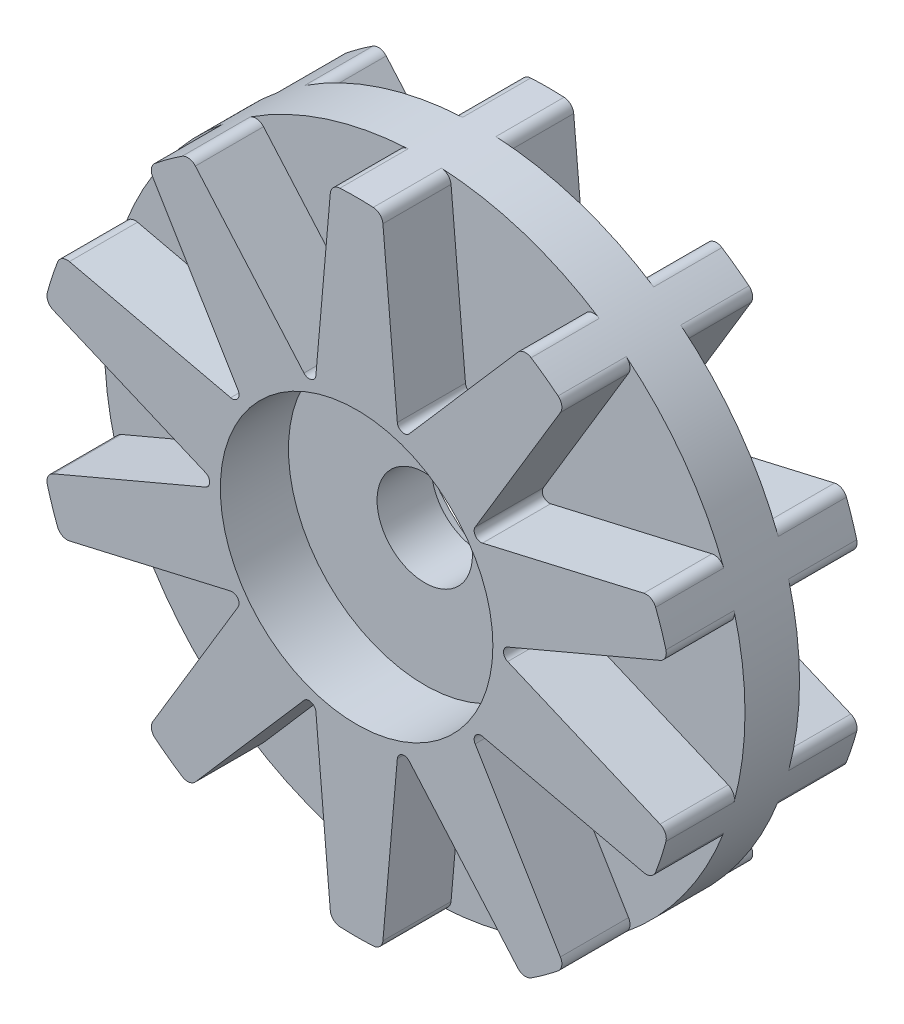
from build123d import *

# Parameters (mm, degrees)
SCHIZZO1_R                   = 94
SCHIZZO1_R_2                 = 14
ESTRUSIONE_ESTRUSIONE1_DEPTH = 16
SCHIZZO2_R                   = 40
ESTRUSIONE_ESTRUSIONE2_DEPTH = 20
RIPETIZIONE_A_L1_COUNT       = 2
RIPETIZIONE_A_L1_PITCH       = 36


with BuildPart() as part:
    # Schizzo1 → Estrusione-Estrusione1 (new body)
    with BuildSketch(Plane.XY):
        Circle(SCHIZZO1_R)
        Circle(SCHIZZO1_R_2, mode=Mode.SUBTRACT)
    extrude(amount=ESTRUSIONE_ESTRUSIONE1_DEPTH)

    # Schizzo2 → Estrusione-Estrusione2 (add)
    with BuildSketch(Plane.XY.offset(16)):
        with BuildLine():
            Line((-7.723794743, 91.137719524), (-11.950583321, 42.738141458))
            ThreePointArc((-11.950583321, 42.738141458), (-12.3776863, 41.667234504), (-13.32496596, 41.010028369))
            ThreePointArc((-13.32496596, 41.010028369), (-14.477627377, 40.984922287), (-15.45262426, 41.60025938))
            Line((-15.45262426, 41.60025938), (-47.320726256, 78.271896566))
            ThreePointArc((-47.320726256, 78.271896566), (-49.167859056, 79.274908037), (-51.219838417, 78.819592441))
            ThreePointArc((-51.219838417, 78.819592441), (-55.251813715, 76.047597471), (-59.134086483, 73.069554644))
            ThreePointArc((-59.134086483, 73.069554644), (-60.201213842, 71.258706558), (-59.818088672, 69.192031282))
            Line((-59.818088672, 69.192031282), (-34.789074258, 27.551506115))
            ThreePointArc((-34.789074258, 27.551506115), (-34.505144513, 26.434079358), (-34.885213782, 25.345591411))
            ThreePointArc((-34.885213782, 25.345591411), (-35.802979473, 24.647762783), (-36.953454589, 24.572492159))
            Line((-36.953454589, 24.572492159), (-84.290338197, 35.508869483))
            ThreePointArc((-84.290338197, 35.508869483), (-86.374255374, 35.23460539), (-87.766713757, 33.660124128))
            ThreePointArc((-87.766713757, 33.660124128), (-89.399312532, 29.047597471), (-90.789687523, 24.356367536))
            ThreePointArc((-90.789687523, 24.356367536), (-90.588621893, 22.264118936), (-89.063905871, 20.817338841))
            Line((-89.063905871, 20.817338841), (-44.339321267, 1.841131878))
            ThreePointArc((-44.339321267, 1.841131878), (-43.452810309, 1.104004358), (-43.120495645, 0))
            ThreePointArc((-43.120495645, 0), (-43.452810309, -1.104004358), (-44.339321267, -1.841131878))
            Line((-44.339321267, -1.841131878), (-89.063905871, -20.817338841))
            ThreePointArc((-89.063905871, -20.817338841), (-90.588621893, -22.264118936), (-90.789687523, -24.356367536))
            ThreePointArc((-90.789687523, -24.356367536), (-89.399312532, -29.047597471), (-87.766713757, -33.660124128))
            ThreePointArc((-87.766713757, -33.660124128), (-86.374255374, -35.23460539), (-84.290338197, -35.508869483))
            Line((-84.290338197, -35.508869483), (-36.953454589, -24.572492159))
            ThreePointArc((-36.953454589, -24.572492159), (-35.802979473, -24.647762783), (-34.885213782, -25.345591411))
            ThreePointArc((-34.885213782, -25.345591411), (-34.505144513, -26.434079358), (-34.789074258, -27.551506115))
            Line((-34.789074258, -27.551506115), (-59.818088672, -69.192031282))
            ThreePointArc((-59.818088672, -69.192031282), (-60.201213842, -71.258706558), (-59.134086483, -73.069554644))
            ThreePointArc((-59.134086483, -73.069554644), (-55.251813715, -76.047597471), (-51.219838417, -78.819592441))
            ThreePointArc((-51.219838417, -78.819592441), (-49.167859056, -79.274908037), (-47.320726256, -78.271896566))
            Line((-47.320726256, -78.271896566), (-15.45262426, -41.60025938))
            ThreePointArc((-15.45262426, -41.60025938), (-14.477627377, -40.984922287), (-13.32496596, -41.010028369))
            ThreePointArc((-13.32496596, -41.010028369), (-12.3776863, -41.667234504), (-11.950583321, -42.738141458))
            Line((-11.950583321, -42.738141458), (-7.723794743, -91.137719524))
            ThreePointArc((-7.723794743, -91.137719524), (-6.818988268, -93.034890269), (-4.8912743, -93.872655421))
            ThreePointArc((-4.8912743, -93.872655421), (0, -94), (4.8912743, -93.872655421))
            ThreePointArc((4.8912743, -93.872655421), (6.818988268, -93.034890269), (7.723794743, -91.137719524))
            Line((7.723794743, -91.137719524), (11.950583321, -42.738141458))
            ThreePointArc((11.950583321, -42.738141458), (12.3776863, -41.667234504), (13.32496596, -41.010028369))
            ThreePointArc((13.32496596, -41.010028369), (14.477627377, -40.984922287), (15.45262426, -41.60025938))
            Line((15.45262426, -41.60025938), (47.320726256, -78.271896566))
            ThreePointArc((47.320726256, -78.271896566), (49.167859056, -79.274908037), (51.219838417, -78.819592441))
            ThreePointArc((51.219838417, -78.819592441), (55.251813715, -76.047597471), (59.134086483, -73.069554644))
            ThreePointArc((59.134086483, -73.069554644), (60.201213842, -71.258706558), (59.818088672, -69.192031282))
            Line((59.818088672, -69.192031282), (34.789074258, -27.551506115))
            ThreePointArc((34.789074258, -27.551506115), (34.505144513, -26.434079358), (34.885213782, -25.345591411))
            ThreePointArc((34.885213782, -25.345591411), (35.802979473, -24.647762783), (36.953454589, -24.572492159))
            Line((36.953454589, -24.572492159), (84.290338197, -35.508869483))
            ThreePointArc((84.290338197, -35.508869483), (86.374255374, -35.23460539), (87.766713757, -33.660124128))
            ThreePointArc((87.766713757, -33.660124128), (89.399312532, -29.047597471), (90.789687523, -24.356367536))
            ThreePointArc((90.789687523, -24.356367536), (90.588621893, -22.264118936), (89.063905871, -20.817338841))
            Line((89.063905871, -20.817338841), (44.339321267, -1.841131878))
            ThreePointArc((44.339321267, -1.841131878), (43.452810309, -1.104004358), (43.120495645, 0))
            ThreePointArc((43.120495645, 0), (43.452810309, 1.104004358), (44.339321267, 1.841131878))
            Line((44.339321267, 1.841131878), (89.063905871, 20.817338841))
            ThreePointArc((89.063905871, 20.817338841), (90.588621893, 22.264118936), (90.789687523, 24.356367536))
            ThreePointArc((90.789687523, 24.356367536), (89.399312532, 29.047597471), (87.766713757, 33.660124128))
            ThreePointArc((87.766713757, 33.660124128), (86.374255374, 35.23460539), (84.290338197, 35.508869483))
            Line((84.290338197, 35.508869483), (36.953454589, 24.572492159))
            ThreePointArc((36.953454589, 24.572492159), (35.802979473, 24.647762783), (34.885213782, 25.345591411))
            ThreePointArc((34.885213782, 25.345591411), (34.505144513, 26.434079358), (34.789074258, 27.551506115))
            Line((34.789074258, 27.551506115), (59.818088672, 69.192031282))
            ThreePointArc((59.818088672, 69.192031282), (60.201213842, 71.258706558), (59.134086483, 73.069554644))
            ThreePointArc((59.134086483, 73.069554644), (55.251813715, 76.047597471), (51.219838417, 78.819592441))
            ThreePointArc((51.219838417, 78.819592441), (49.167859056, 79.274908037), (47.320726256, 78.271896566))
            Line((47.320726256, 78.271896566), (15.45262426, 41.60025938))
            ThreePointArc((15.45262426, 41.60025938), (14.477627377, 40.984922287), (13.32496596, 41.010028369))
            ThreePointArc((13.32496596, 41.010028369), (12.3776863, 41.667234504), (11.950583321, 42.738141458))
            Line((11.950583321, 42.738141458), (7.723794743, 91.137719524))
            ThreePointArc((7.723794743, 91.137719524), (6.818988268, 93.034890269), (4.8912743, 93.872655421))
            ThreePointArc((4.8912743, 93.872655421), (0, 94), (-4.8912743, 93.872655421))
            ThreePointArc((-4.8912743, 93.872655421), (-6.818988268, 93.034890269), (-7.723794743, 91.137719524))
        make_face()
        Circle(SCHIZZO2_R, mode=Mode.SUBTRACT)
    estrusione_estrusione2 = extrude(amount=ESTRUSIONE_ESTRUSIONE2_DEPTH)

    # Ripetizione a L1: Estrusione-Estrusione2 ×2
    with Locations(*[(0, 0, -i * RIPETIZIONE_A_L1_PITCH) for i in range(1, RIPETIZIONE_A_L1_COUNT)]):
        add(estrusione_estrusione2)


solid = part.part
